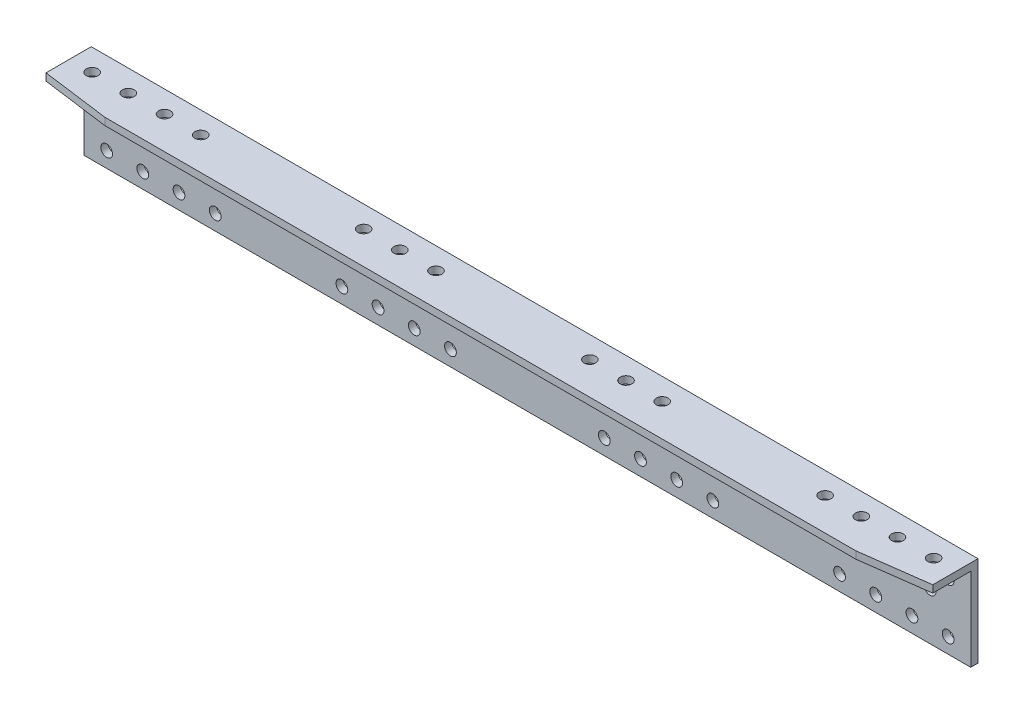
from build123d import *

# Parameters (mm, degrees)
SKETCH_1_W          = 1960
SKETCH_1_H          = 200
SKETCH_1_R          = 13
EXTRUDE_1637_DEPTH  = 16
SKETCH_2_W          = 1960
SKETCH_2_H          = 16
EXTRUDE_1_DEPTH     = 104
SKETCH_3_R          = 13
CUT_EXTRUDE_1_DEPTH = 1008.372820757


with BuildPart() as part:
    # 草图1 → Extrude 1637 (new body)
    with BuildSketch(Plane.XY):
        with Locations((0, 100)):
            Rectangle(SKETCH_1_W, SKETCH_1_H)
        with Locations((930, 146)):
            Circle(SKETCH_1_R, mode=Mode.SUBTRACT)
        with Locations(Location((-890, 106, 0), (0, 0, 180))):
            Circle(SKETCH_1_R, mode=Mode.SUBTRACT)
        with Locations((850, 146)):
            Circle(SKETCH_1_R, mode=Mode.SUBTRACT)
        with Locations((930, 34)):
            Circle(SKETCH_1_R, mode=Mode.SUBTRACT)
        with Locations((850, 34)):
            Circle(SKETCH_1_R, mode=Mode.SUBTRACT)
        with Locations(Location((-810, 106, 0), (0, 0, 180))):
            Circle(SKETCH_1_R, mode=Mode.SUBTRACT)
        with Locations((770, 34)):
            Circle(SKETCH_1_R, mode=Mode.SUBTRACT)
        with Locations((770, 146)):
            Circle(SKETCH_1_R, mode=Mode.SUBTRACT)
        with Locations(Location((-730, 106, 0), (0, 0, 180))):
            Circle(SKETCH_1_R, mode=Mode.SUBTRACT)
        with Locations((690, 146)):
            Circle(SKETCH_1_R, mode=Mode.SUBTRACT)
        with Locations((690, 34)):
            Circle(SKETCH_1_R, mode=Mode.SUBTRACT)
        with Locations(Location((-650, 106, 0), (0, 0, 180))):
            Circle(SKETCH_1_R, mode=Mode.SUBTRACT)
        with Locations(Location((170, 146, 0), (0, 0, 180))):
            Circle(SKETCH_1_R, mode=Mode.SUBTRACT)
        with Locations(Location((170, 34, 0), (0, 0, 180))):
            Circle(SKETCH_1_R, mode=Mode.SUBTRACT)
        with Locations(Location((-410, 146, 0), (0, 0, 180))):
            Circle(SKETCH_1_R, mode=Mode.SUBTRACT)
        with Locations(Location((250, 34, 0), (0, 0, 180))):
            Circle(SKETCH_1_R, mode=Mode.SUBTRACT)
        with Locations(Location((250, 146, 0), (0, 0, 180))):
            Circle(SKETCH_1_R, mode=Mode.SUBTRACT)
        with Locations(Location((-450, 106, 0), (0, 0, 180))):
            Circle(SKETCH_1_R, mode=Mode.SUBTRACT)
        with Locations(Location((330, 34, 0), (0, 0, 180))):
            Circle(SKETCH_1_R, mode=Mode.SUBTRACT)
        with Locations(Location((330, 146, 0), (0, 0, 180))):
            Circle(SKETCH_1_R, mode=Mode.SUBTRACT)
        with Locations(Location((-370, 106, 0), (0, 0, 180))):
            Circle(SKETCH_1_R, mode=Mode.SUBTRACT)
        with Locations(Location((-290, 106, 0), (0, 0, 180))):
            Circle(SKETCH_1_R, mode=Mode.SUBTRACT)
        with Locations(Location((-210, 106, 0), (0, 0, 180))):
            Circle(SKETCH_1_R, mode=Mode.SUBTRACT)
        with Locations((890, 106)):
            Circle(SKETCH_1_R, mode=Mode.SUBTRACT)
        with Locations((810, 106)):
            Circle(SKETCH_1_R, mode=Mode.SUBTRACT)
        with Locations((650, 106)):
            Circle(SKETCH_1_R, mode=Mode.SUBTRACT)
        with Locations((730, 106)):
            Circle(SKETCH_1_R, mode=Mode.SUBTRACT)
        with Locations((-330, 146)):
            Circle(SKETCH_1_R, mode=Mode.SUBTRACT)
        with Locations((-330, 34)):
            Circle(SKETCH_1_R, mode=Mode.SUBTRACT)
        with Locations((410, 146)):
            Circle(SKETCH_1_R, mode=Mode.SUBTRACT)
        with Locations((-250, 146)):
            Circle(SKETCH_1_R, mode=Mode.SUBTRACT)
        with Locations((-250, 34)):
            Circle(SKETCH_1_R, mode=Mode.SUBTRACT)
        with Locations((450, 106)):
            Circle(SKETCH_1_R, mode=Mode.SUBTRACT)
        with Locations((-170, 34)):
            Circle(SKETCH_1_R, mode=Mode.SUBTRACT)
        with Locations((-170, 146)):
            Circle(SKETCH_1_R, mode=Mode.SUBTRACT)
        with Locations((370, 106)):
            Circle(SKETCH_1_R, mode=Mode.SUBTRACT)
        with Locations(Location((-690, 146, 0), (0, 0, 180))):
            Circle(SKETCH_1_R, mode=Mode.SUBTRACT)
        with Locations((290, 106)):
            Circle(SKETCH_1_R, mode=Mode.SUBTRACT)
        with Locations(Location((-770, 146, 0), (0, 0, 180))):
            Circle(SKETCH_1_R, mode=Mode.SUBTRACT)
        with Locations((210, 106)):
            Circle(SKETCH_1_R, mode=Mode.SUBTRACT)
        with Locations(Location((-850, 146, 0), (0, 0, 180))):
            Circle(SKETCH_1_R, mode=Mode.SUBTRACT)
        with Locations((130, 106)):
            Circle(SKETCH_1_R, mode=Mode.SUBTRACT)
        with Locations(Location((-930, 146, 0), (0, 0, 180))):
            Circle(SKETCH_1_R, mode=Mode.SUBTRACT)
        with Locations(Location((-690, 34, 0), (0, 0, 180))):
            Circle(SKETCH_1_R, mode=Mode.SUBTRACT)
        with Locations(Location((-770, 34, 0), (0, 0, 180))):
            Circle(SKETCH_1_R, mode=Mode.SUBTRACT)
        with Locations(Location((-850, 34, 0), (0, 0, 180))):
            Circle(SKETCH_1_R, mode=Mode.SUBTRACT)
        with Locations(Location((-930, 34, 0), (0, 0, 180))):
            Circle(SKETCH_1_R, mode=Mode.SUBTRACT)
        with Locations(Location((-130, 106, 0), (0, 0, 180))):
            Circle(SKETCH_1_R, mode=Mode.SUBTRACT)
        with Locations((410, 34)):
            Circle(SKETCH_1_R, mode=Mode.SUBTRACT)
        with Locations(Location((-410, 34, 0), (0, 0, 180))):
            Circle(SKETCH_1_R, mode=Mode.SUBTRACT)
    extrude(amount=EXTRUDE_1637_DEPTH)

    # 草图2 → 凸台-拉伸1 (add)
    with BuildSketch(Plane.XY.offset(16)):
        with Locations((0, 192)):
            Rectangle(SKETCH_2_W, SKETCH_2_H)
    extrude(amount=EXTRUDE_1_DEPTH)

    # 草图3 → 切除-拉伸1 (cut, through all)
    with BuildSketch(Plane(origin=(0, 200, 0), x_dir=(-1, 0, 0), z_dir=(0, 1, 0))):
        with Locations(Location((-930, 48, 0), (0, 0, 90))):
            Circle(SKETCH_3_R)
        with Locations(Location((-850, 48, 0), (0, 0, 90))):
            Circle(SKETCH_3_R)
        with Locations(Location((-770, 48, 0), (0, 0, 90))):
            Circle(SKETCH_3_R)
        with Locations(Location((-690, 48, 0), (0, 0, 90))):
            Circle(SKETCH_3_R)
        with Locations(Location((-330, 48, 0), (0, 0, 90))):
            Circle(SKETCH_3_R)
        with Locations(Location((-250, 48, 0), (0, 0, 90))):
            Circle(SKETCH_3_R)
        with Locations(Location((-170, 48, 0), (0, 0, 90))):
            Circle(SKETCH_3_R)
        with Locations(Location((170, 48, 0), (0, 0, 90))):
            Circle(SKETCH_3_R)
        with Locations(Location((250, 48, 0), (0, 0, 90))):
            Circle(SKETCH_3_R)
        with Locations(Location((330, 48, 0), (0, 0, 90))):
            Circle(SKETCH_3_R)
        with Locations(Location((930, 48, 0), (0, 0, 90))):
            Circle(SKETCH_3_R)
        with Locations(Location((850, 48, 0), (0, 0, 90))):
            Circle(SKETCH_3_R)
        with Locations(Location((770, 48, 0), (0, 0, 90))):
            Circle(SKETCH_3_R)
        with Locations(Location((690, 48, 0), (0, 0, 90))):
            Circle(SKETCH_3_R)
        Polygon((-980, 100), (-830, 120), (-980, 120), align=None)
        Polygon((980, 100), (830, 120), (980, 120), align=None)
    extrude(amount=-CUT_EXTRUDE_1_DEPTH, mode=Mode.SUBTRACT)


solid = part.part
